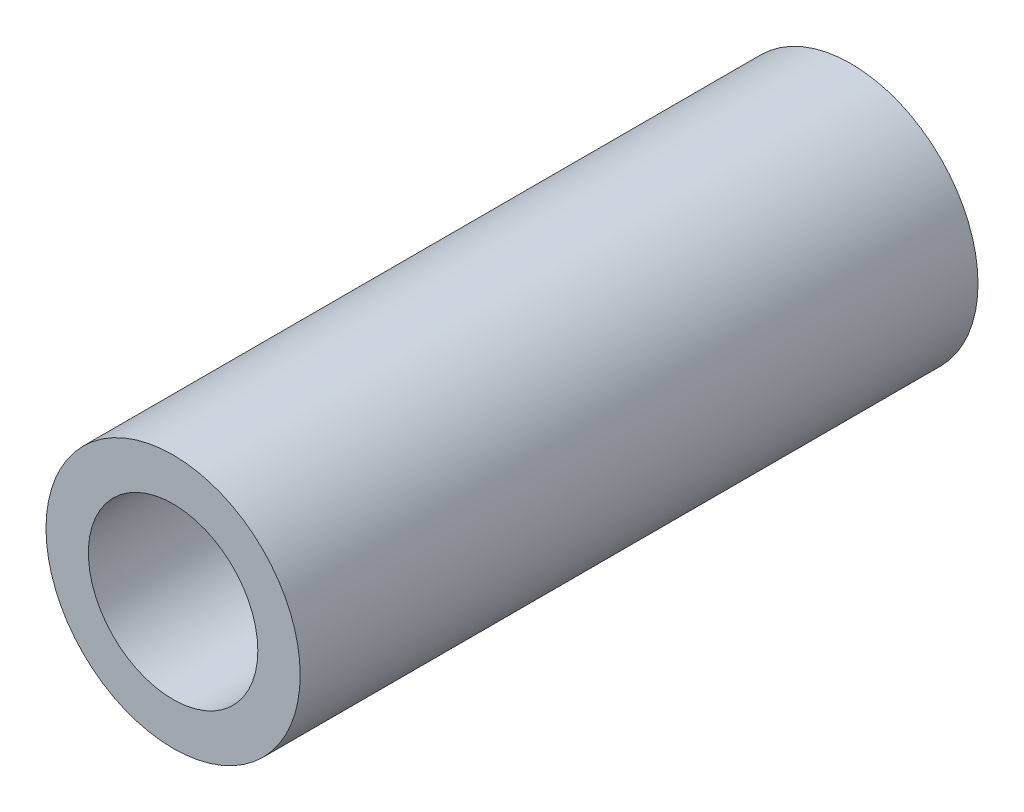
from build123d import *

# Parameters (mm, degrees)
SKETCH1_R           = 7.5
BOSS_EXTRUDE1_DEPTH = 40
SKETCH2_R           = 5
CUT_EXTRUDE1_DEPTH  = 10
CUT_EXTRUDE2_START  = -10
SKETCH3_R           = 5
CUT_EXTRUDE2_DEPTH  = 10


with BuildPart() as part:
    # Sketch1 → Boss-Extrude1 (new body)
    with BuildSketch(Plane.XY):
        Circle(SKETCH1_R)
    extrude(amount=BOSS_EXTRUDE1_DEPTH)

    # Sketch2 → Cut-Extrude1 (cut)
    with BuildSketch(Plane.XY.offset(40)):
        Circle(SKETCH2_R)
    extrude(amount=-CUT_EXTRUDE1_DEPTH, mode=Mode.SUBTRACT)

    # Sketch3 → Cut-Extrude2 (cut)
    with BuildSketch(Plane(origin=(0, 0, 0), x_dir=(-1, 0, 0), z_dir=(0, 0, -1)).offset(CUT_EXTRUDE2_START)):
        with Locations(Location((0, 0, 0), (0, 0, 180))):
            Circle(SKETCH3_R)
    extrude(amount=CUT_EXTRUDE2_DEPTH, mode=Mode.SUBTRACT)


solid = part.part
